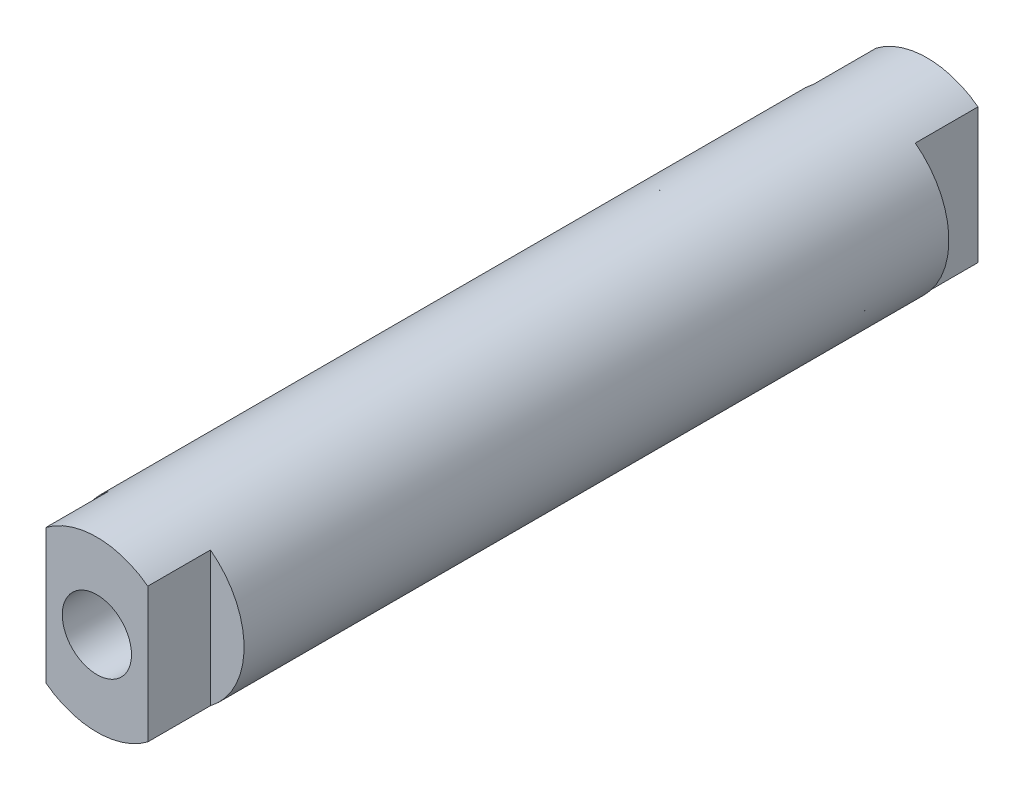
from build123d import *

# Parameters (mm, degrees)
SKETCH1_R           = 10.9855
BOSS_EXTRUDE1_DEPTH = 53.975
CUT_EXTRUDE1_DEPTH  = 8.1534
CUT_EXTRUDE2_START  = -3
SKETCH3_R           = 9.525
CUT_EXTRUDE2_DEPTH  = 85.6432
SKETCH5_R           = 4.5
CUT_EXTRUDE3_DEPTH  = 110.062206655


with BuildPart() as part:
    # Sketch1 → Boss-Extrude1 (new, symmetric)
    with BuildSketch(Plane.XY):
        Circle(SKETCH1_R)
    extrude(amount=BOSS_EXTRUDE1_DEPTH, both=True)

    # Sketch2 → Cut-Extrude1 (cut)
    with BuildSketch(Plane.XY.offset(53.975)):
        with BuildLine():
            Line((-6.6167, 8.769292523), (-6.6167, -8.769292523))
            ThreePointArc((-6.6167, -8.769292523), (-10.9855, 0), (-6.6167, 8.769292523))
        make_face()
        with BuildLine():
            Line((6.6167, -8.769292523), (6.6167, 8.769292523))
            ThreePointArc((6.6167, 8.769292523), (10.9855, 0), (6.6167, -8.769292523))
        make_face()
    cut_extrude1 = extrude(amount=-CUT_EXTRUDE1_DEPTH, mode=Mode.SUBTRACT)

    # Mirror1: Cut-Extrude1 across plane
    add(cut_extrude1.mirror(Plane.XY), mode=Mode.SUBTRACT)

    # Sketch3 → Cut-Extrude2 (cut)
    with BuildSketch(Plane.XY.offset(45.8216).offset(CUT_EXTRUDE2_START)):
        Circle(SKETCH3_R)
    extrude(amount=-CUT_EXTRUDE2_DEPTH, mode=Mode.SUBTRACT)

    # Sketch5 → Cut-Extrude3 (cut, through all)
    with BuildSketch(Plane.XY.offset(53.975)):
        Circle(SKETCH5_R)
    extrude(amount=-CUT_EXTRUDE3_DEPTH, mode=Mode.SUBTRACT)


solid = part.part
